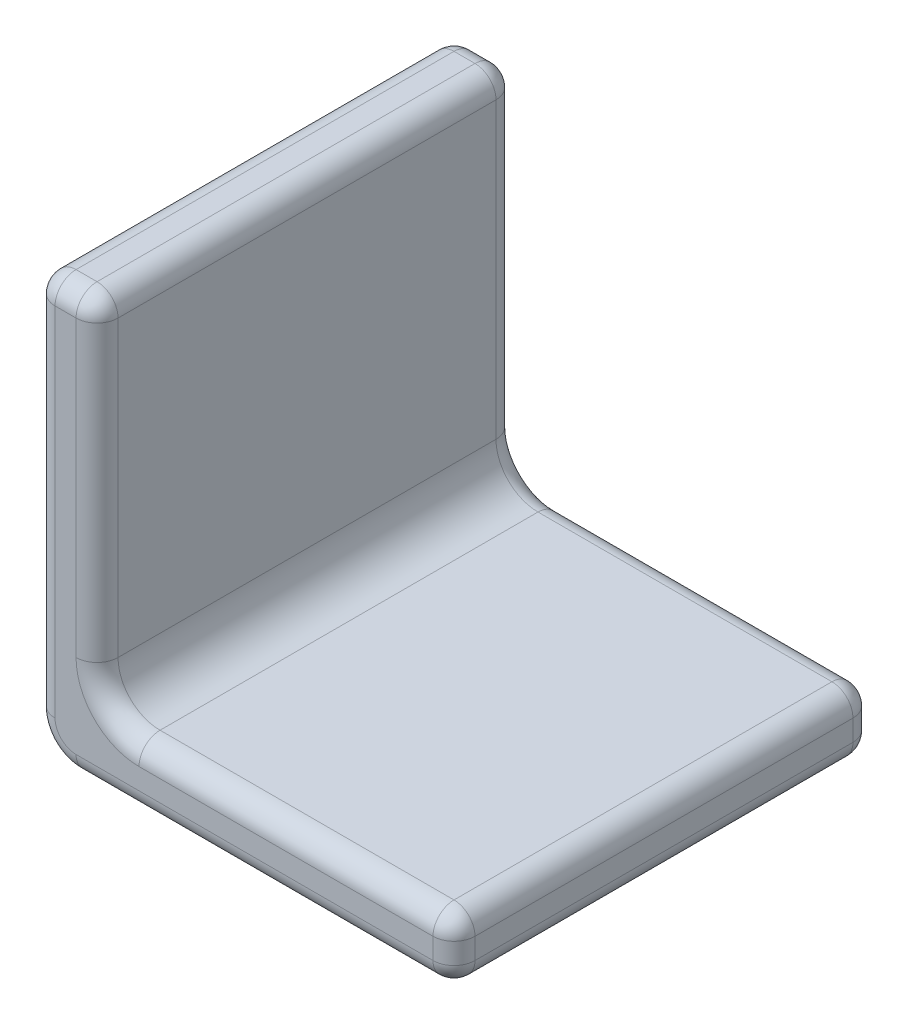
from build123d import *

# Parameters (mm, degrees)
BOSS_EXTRUDE1_DEPTH = 20
FILLET1_R           = 1


with BuildPart() as part:
    # Sketch1 → Boss-Extrude1 (new body)
    with BuildSketch(Plane.XY):
        with BuildLine():
            Line((5.679190751, 0), (19, 0))
            ThreePointArc((19, 0), (19.707106781, 0.292893219), (20, 1))
            Line((20, 1), (20, 2))
            ThreePointArc((20, 2), (19.707106781, 2.707106781), (19, 3))
            Line((19, 3), (5, 3))
            ThreePointArc((5, 3), (3.585786438, 3.585786438), (3, 5))
            Line((3, 5), (3, 19))
            ThreePointArc((3, 19), (2.707106781, 19.707106781), (2, 20))
            Line((2, 20), (1, 20))
            ThreePointArc((1, 20), (0.292893219, 19.707106781), (0, 19))
            Line((0, 19), (0, 2))
            ThreePointArc((0, 2), (0.585786438, 0.585786438), (2, 0))
            Line((2, 0), (5.679190751, 0))
        make_face()
    extrude(amount=BOSS_EXTRUDE1_DEPTH)

    # Fillet1
    fillet1_edges = [part.edges().sort_by_distance(p)[0] for p in [
        (2.707106781, 19.707106781, 20),
        (12, 3, 0),
        (19.707106781, 2.707106781, 0),
        (20, 1.5, 0),
        (19.707106781, 0.292893219, 0),
        (10.5, 0, 0),
        (0.585786438, 0.585786438, 0),
        (0, 10.5, 0),
        (0.292893219, 19.707106781, 0),
        (1.5, 20, 0),
        (1.5, 20, 20),
        (2.707106781, 19.707106781, 0),
        (3, 12, 0),
        (3.585786438, 3.585786438, 0),
        (0.292893219, 19.707106781, 20),
        (0, 10.5, 20),
        (0.585786438, 0.585786438, 20),
        (10.5, 0, 20),
        (19.707106781, 0.292893219, 20),
        (20, 1.5, 20),
        (19.707106781, 2.707106781, 20),
        (3.585786438, 3.585786438, 20),
        (12, 3, 20),
        (3, 12, 20),
    ]]
    fillet(fillet1_edges, radius=FILLET1_R)


solid = part.part
